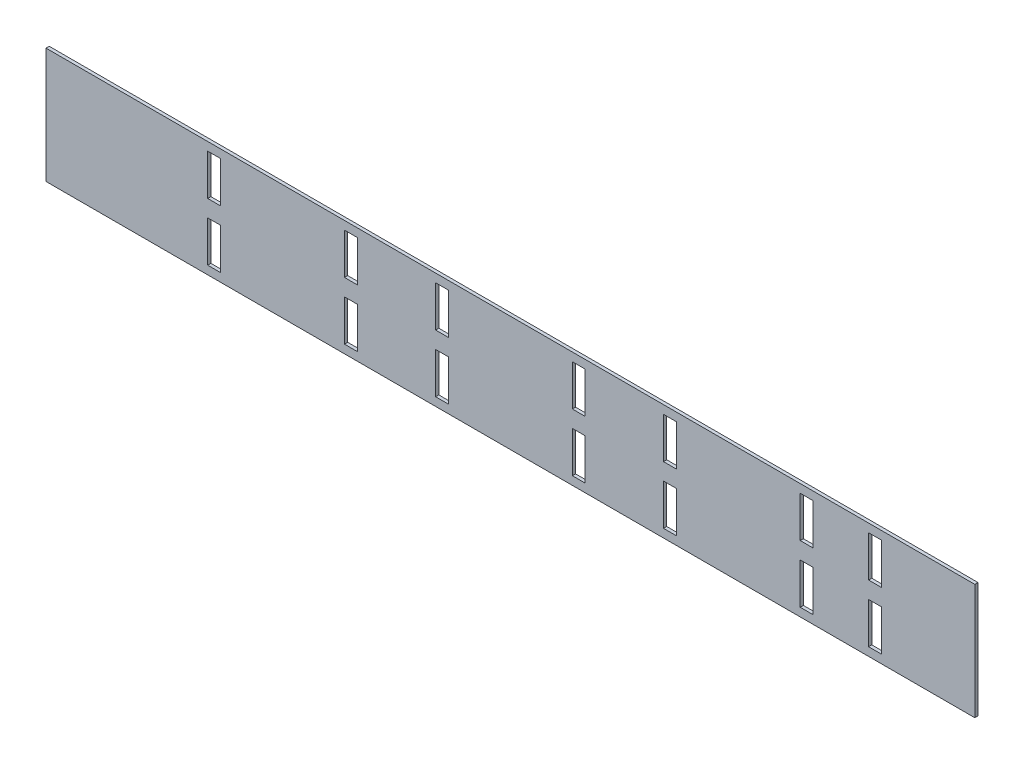
from build123d import *

# Parameters (mm, degrees)
SKETCH12_W          = 460.674
SKETCH12_H          = 57.3
SKETCH12_W_2        = 6.401239002
SKETCH12_H_2        = 20.32
BOSS_EXTRUDE5_DEPTH = 1.5875


with BuildPart() as part:
    # Sketch12 → Boss-Extrude5 (new body)
    with BuildSketch(Plane.XY):
        with Locations((82.08822952, 30.015906355)):
            Rectangle(SKETCH12_W, SKETCH12_H)
        with Locations((161.20922952, 44.340306355)):
            Rectangle(SKETCH12_W_2, SKETCH12_H_2, mode=Mode.SUBTRACT)
        with Locations((115.99722952, 44.340306355)):
            Rectangle(SKETCH12_W_2, SKETCH12_H_2, mode=Mode.SUBTRACT)
        with Locations((115.99722952, 15.689106355)):
            Rectangle(SKETCH12_W_2, SKETCH12_H_2, mode=Mode.SUBTRACT)
        with Locations((161.20922952, 15.689106355)):
            Rectangle(SKETCH12_W_2, SKETCH12_H_2, mode=Mode.SUBTRACT)
        with Locations((229.02722952, 44.340306355)):
            Rectangle(SKETCH12_W_2, SKETCH12_H_2, mode=Mode.SUBTRACT)
        with Locations((229.02722952, 15.689106355)):
            Rectangle(SKETCH12_W_2, SKETCH12_H_2, mode=Mode.SUBTRACT)
        with Locations((262.93622952, 44.340306355)):
            Rectangle(SKETCH12_W_2, SKETCH12_H_2, mode=Mode.SUBTRACT)
        with Locations((262.93622952, 15.689106355)):
            Rectangle(SKETCH12_W_2, SKETCH12_H_2, mode=Mode.SUBTRACT)
        with Locations((48.17922952, 44.340306355)):
            Rectangle(SKETCH12_W_2, SKETCH12_H_2, mode=Mode.SUBTRACT)
        with Locations((48.17922952, 15.689106355)):
            Rectangle(SKETCH12_W_2, SKETCH12_H_2, mode=Mode.SUBTRACT)
        with Locations((2.96722952, 44.340306355)):
            Rectangle(SKETCH12_W_2, SKETCH12_H_2, mode=Mode.SUBTRACT)
        with Locations((2.96722952, 15.689106355)):
            Rectangle(SKETCH12_W_2, SKETCH12_H_2, mode=Mode.SUBTRACT)
        with Locations((-64.85077048, 44.340306355)):
            Rectangle(SKETCH12_W_2, SKETCH12_H_2, mode=Mode.SUBTRACT)
        with Locations((-64.85077048, 15.689106355)):
            Rectangle(SKETCH12_W_2, SKETCH12_H_2, mode=Mode.SUBTRACT)
    extrude(amount=BOSS_EXTRUDE5_DEPTH)


solid = part.part
